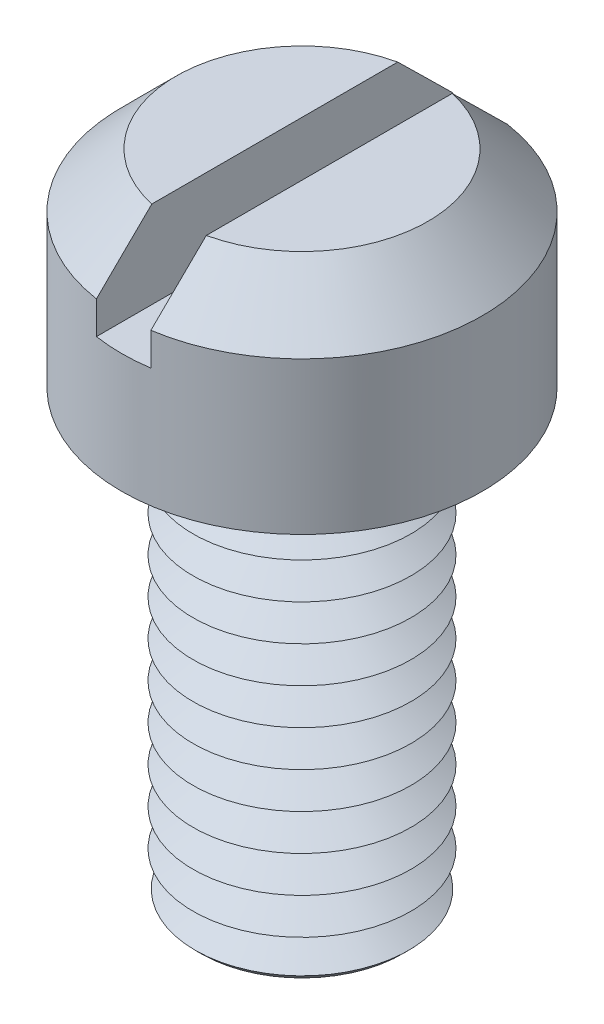
from build123d import *

# Parameters (mm, degrees)
SKETCH2_W            = 0.381
SKETCH2_H            = 32.152963302
HEX_CUT_DRIVEN_DEPTH = 0.6096


with BuildPart() as part:
    # Sketch3 → Shank Revolve ( driven ) (revolve)
    with BuildSketch(Plane.XY, mode=Mode.PRIVATE) as shank_revolve_driven_sk:
        Polygon((0, 0.835152), (0, -3.175), (0.6096, -3.175), (0.762, -3.0226), (0.762, 0.835152), align=None)
    revolve(shank_revolve_driven_sk.sketch.rotate(Axis((0, -50, 0), (0, 1, 0)), 90), axis=Axis((0, -50, 0), (0, 1, 0)))

    # Sketch4 → Thread Revolve Cut ( driven ) (revolve, cut)
    with BuildSketch(Plane.XY, mode=Mode.PRIVATE) as thread_revolve_cut_driven_sk:
        Polygon((0.542029547, 0.635), (0.762, 0.762), (1.27, 0.762), (1.27, -3.81), (0.762, -3.81), (0.542029547, -3.683), (0.762, -3.556), (0.542029547, -3.429), (0.762, -3.302), (0.542029547, -3.175), (0.762, -3.048), (0.542029547, -2.921), (0.762, -2.794), (0.542029547, -2.667), (0.762, -2.54), (0.542029547, -2.413), (0.762, -2.286), (0.542029547, -2.159), (0.762, -2.032), (0.542029547, -1.905), (0.762, -1.778), (0.542029547, -1.651), (0.762, -1.524), (0.542029547, -1.397), (0.762, -1.27), (0.542029547, -1.143), (0.762, -1.016), (0.542029547, -0.889), (0.762, -0.762), (0.542029547, -0.635), (0.762, -0.508), (0.542029547, -0.381), (0.762, -0.254), (0.542029547, -0.127), (0.762, 0), (0.542029547, 0.127), (0.762, 0.254), (0.542029547, 0.381), (0.762, 0.508), align=None)
    revolve(thread_revolve_cut_driven_sk.sketch.rotate(Axis((0, -50, 0), (0, 1, 0)), 90), axis=Axis((0, -50, 0), (0, 1, 0)), mode=Mode.SUBTRACT)

    # Sketch5 → Head Revolve ( driven ) (revolve)
    with BuildSketch(Plane.XY, mode=Mode.PRIVATE) as head_revolve_driven_sk:
        Polygon((0, 1.444752), (0, 0), (1.261872, 0), (1.261872, 1.063752), (0.880872, 1.444752), align=None)
    revolve(head_revolve_driven_sk.sketch.rotate(Axis((0, -50, 0), (0, 1, 0)), 270), axis=Axis((0, -50, 0), (0, 1, 0)))

    # Sketch2 → Hex Cut ( driven ) (cut)
    with BuildSketch(Plane(origin=(0, 1.444752, 0), x_dir=(-1, 0, 0), z_dir=(0, 1, 0))):
        Rectangle(SKETCH2_W, SKETCH2_H)
    extrude(amount=-HEX_CUT_DRIVEN_DEPTH, mode=Mode.SUBTRACT)


solid = part.part
